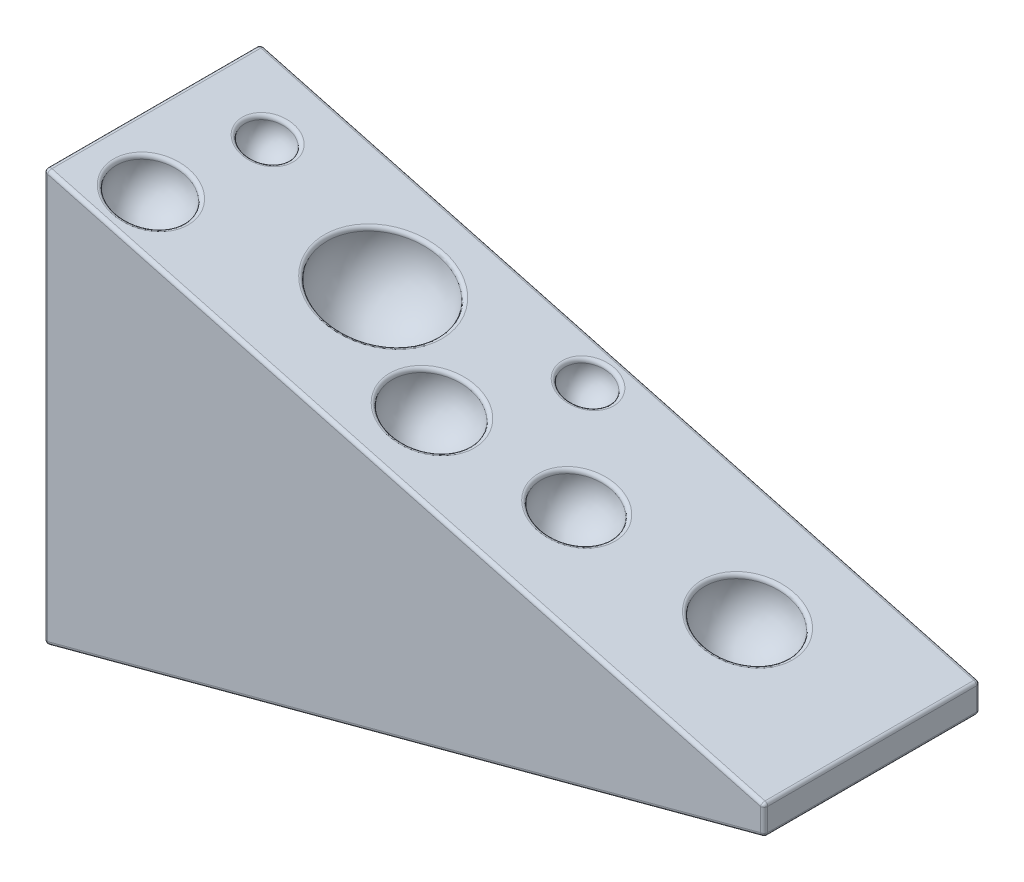
from build123d import *

# Parameters (mm, degrees)
BOSS_EXTRUDE1_DEPTH = 60
FILLET1_R           = 1


with BuildPart() as part:
    # Sketch1 → Boss-Extrude1 (new body)
    with BuildSketch(Plane.XY):
        Polygon((0, 0), (200, 53.589838486), (200, 61.410161514), (0, 115), align=None)
    extrude(amount=BOSS_EXTRUDE1_DEPTH)

    # Sketch2 → Cut-Revolve1 (revolve, cut)
    with BuildSketch(Plane(origin=(0, 0, 0), x_dir=(0.9659258262890682, 0.2588190451025213, 0), z_dir=(0.2588190451025213, -0.9659258262890682, 0))):
        with BuildLine():
            Line((117.055236082, 35), (137.055236082, 35))
            ThreePointArc((137.055236082, 35), (127.055236082, 45), (117.055236082, 35))
        make_face()
    cut_revolve1 = revolve(axis=Axis((113.066675634, 30.296124427, 35), (0.9659258262890682, 0.25881904510252135, 0)), mode=Mode.SUBTRACT)

    # Sketch4 → Cut-Revolve2 (revolve, cut)
    with BuildSketch(Plane(origin=(0, 0, 0), x_dir=(0.9659258262890682, 0.2588190451025213, 0), z_dir=(0.2588190451025213, -0.9659258262890682, 0))):
        with BuildLine():
            Line((7.099393369, 46.767577135), (26.536388721, 46.767577135))
            ThreePointArc((26.536388721, 46.767577135), (16.817891045, 56.486074811), (7.099393369, 46.767577135))
        make_face()
    cut_revolve2 = revolve(axis=Axis((6.857487406, 1.837458212, 46.767577135), (0.9659258262890682, 0.25881904510252135, 0)), mode=Mode.SUBTRACT)

    # Sketch5 → Cut-Revolve3 (revolve, cut)
    with BuildSketch(Plane(origin=(0, 0, 0), x_dir=(0.9659258262890682, 0.2588190451025213, 0), z_dir=(0.2588190451025213, -0.9659258262890682, 0))):
        with BuildLine():
            Line((45.87566904, 25.680428757), (77.654871524, 25.680428757))
            ThreePointArc((77.654871524, 25.680428757), (61.765270282, 41.570029999), (45.87566904, 25.680428757))
        make_face()
    cut_revolve3 = revolve(axis=Axis((44.312493524, 11.873496854, 25.680428757), (0.9659258262890682, 0.25881904510252135, 0)), mode=Mode.SUBTRACT)

    # Sketch6 → Cut-Revolve4 (revolve, cut)
    with BuildSketch(Plane(origin=(0, 0, 0), x_dir=(0.9659258262890682, 0.2588190451025213, 0), z_dir=(0.2588190451025213, -0.9659258262890682, 0))):
        with BuildLine():
            Line((156.497088743, 27.606314169), (180.497088743, 27.606314169))
            ThreePointArc((180.497088743, 27.606314169), (168.497088743, 39.606314169), (156.497088743, 27.606314169))
        make_face()
    cut_revolve4 = revolve(axis=Axis((151.164579756, 40.50442707, 27.606314169), (0.9659258262890682, 0.2588190451025212, 0)), mode=Mode.SUBTRACT)

    # Sketch7 → Cut-Revolve5 (revolve, cut)
    with BuildSketch(Plane(origin=(0, 0, 0), x_dir=(0.9659258262890682, 0.2588190451025213, 0), z_dir=(0.2588190451025213, -0.9659258262890682, 0))):
        with BuildLine():
            Line((13.495058904, 17.228447259), (26.08878574, 17.228447259))
            ThreePointArc((26.08878574, 17.228447259), (19.791922322, 23.525310677), (13.495058904, 17.228447259))
        make_face()
    cut_revolve5 = revolve(axis=Axis((13.035225922, 3.492778259, 17.228447259), (0.9659258262890682, 0.2588190451025213, 0)), mode=Mode.SUBTRACT)

    # Sketch8 → Cut-Revolve6 (revolve, cut)
    with BuildSketch(Plane(origin=(0, 0, 0), x_dir=(0.9659258262890682, 0.2588190451025213, 0), z_dir=(0.2588190451025213, -0.9659258262890682, 0))):
        with BuildLine():
            Line((97.589817269, 9.551450933), (110.308605964, 9.551450933))
            ThreePointArc((110.308605964, 9.551450933), (103.949211617, 15.910845281), (97.589817269, 9.551450933))
        make_face()
    cut_revolve6 = revolve(axis=Axis((94.264524883, 25.258103317, 9.551450933), (0.9659258262890682, 0.25881904510252113, 0)), mode=Mode.SUBTRACT)

    # Sketch9 → Cut-Revolve7 (revolve, cut)
    with BuildSketch(Plane(origin=(0, 0, 0), x_dir=(0.9659258262890682, 0.2588190451025213, 0), z_dir=(0.2588190451025213, -0.9659258262890682, 0))):
        with BuildLine():
            Line((80.476512412, 40.976958262), (102.784397699, 40.976958262))
            ThreePointArc((102.784397699, 40.976958262), (91.630455055, 52.130900906), (80.476512412, 40.976958262))
        make_face()
    cut_revolve7 = revolve(axis=Axis((77.734341748, 20.828854096, 40.976958262), (0.9659258262890682, 0.2588190451025213, 0)), mode=Mode.SUBTRACT)

    # Mirror2: Cut-Revolve1, Cut-Revolve2, Cut-Revolve3, Cut-Revolve4, Cut-Revolve5, Cut-Revolve6, Cut-Revolve7 across plane
    add(cut_revolve1.mirror(Plane.ZX.offset(57)), mode=Mode.SUBTRACT)
    add(cut_revolve2.mirror(Plane.ZX.offset(57)), mode=Mode.SUBTRACT)
    add(cut_revolve3.mirror(Plane.ZX.offset(57)), mode=Mode.SUBTRACT)
    add(cut_revolve4.mirror(Plane.ZX.offset(57)), mode=Mode.SUBTRACT)
    add(cut_revolve5.mirror(Plane.ZX.offset(57)), mode=Mode.SUBTRACT)
    add(cut_revolve6.mirror(Plane.ZX.offset(57)), mode=Mode.SUBTRACT)
    add(cut_revolve7.mirror(Plane.ZX.offset(57)), mode=Mode.SUBTRACT)

    # Fillet1
    fillet1_edges = [part.edges().sort_by_distance(p)[0] for p in [
        (200, 57.5, 60),
        (100, 88.205080757, 60),
        (122.725933897, 32.884314878, 25),
        (16.244835304, 4.352790501, 37.049079459),
        (59.660669733, 15.986028275, 9.790827515),
        (162.755689672, 43.610255611, 15.606314169),
        (19.117528922, 5.122526436, 10.931583841),
        (100.407228123, 26.90403569, 3.192056585),
        (88.508223013, 23.71570688, 29.823015618),
        (113.361842287, 84.624785907, 35),
        (0, 57.5, 60),
        (7.153968756, 113.083099849, 46.767577135),
        (44.590878604, 103.051910088, 25.680428757),
        (100, 88.205080757, 0),
        (151.452191657, 74.418507554, 27.606314169),
        (200, 57.5, 0),
        (13.357213034, 111.420945554, 17.228447259),
        (100, 26.794919243, 0),
        (94.585795805, 89.655812399, 9.551450933),
        (78.024816992, 94.093313297, 40.976958262),
        (0, 57.5, 0),
        (100, 26.794919243, 60),
        (0, 115, 30),
        (200, 61.410161514, 30),
        (200, 53.589838486, 30),
        (0, 0, 30),
    ]]
    fillet(fillet1_edges, radius=FILLET1_R)


solid = part.part
